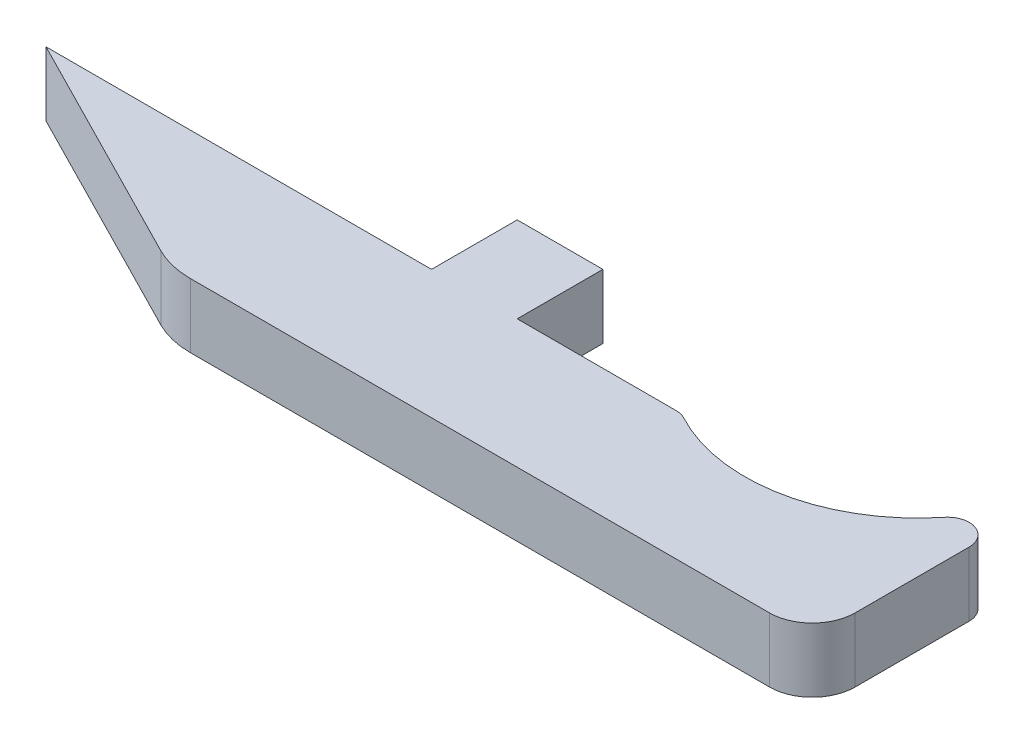
from build123d import *

# Parameters (mm, degrees)
BOSS_EXTRUDE1_DEPTH = 4.7625
FILLET1_R           = 1.5875
FILLET2_R           = 6.35
FILLET3_R           = 3.175
SKETCH6_W           = 6.35
SKETCH6_H           = 4.7625
BOSS_EXTRUDE2_DEPTH = 6.35


with BuildPart() as part:
    # Sketch1 → Boss-Extrude1 (new body)
    with BuildSketch(Plane(origin=(0, 0, 0), x_dir=(1, 0, 0), z_dir=(0, 1, 0))):
        with BuildLine():
            ThreePointArc((71.8451, -2.691968416), (65.44608311, -13.792101845), (52.633598926, -13.817168416))
            Line((52.633598926, -13.817168416), (5.5225, -13.817168416))
            Line((5.5225, -13.817168416), (24.2201, -23.342168416))
            Line((24.2201, -23.342168416), (71.8451, -23.342168416))
            Line((71.8451, -23.342168416), (71.8451, -2.691968416))
        make_face()
    extrude(amount=BOSS_EXTRUDE1_DEPTH)

    # Fillet1
    fillet1_edges = [part.edges().sort_by_distance(p)[0] for p in [
        (71.8451, 2.38125, 2.691968416),
        (52.633598926, 2.38125, 13.817168416),
    ]]
    fillet(fillet1_edges, radius=FILLET1_R)

    # Fillet2
    fillet2_edges = [part.edges().sort_by_distance(p)[0] for p in [
        (24.2201, 2.38125, 23.342168416),
    ]]
    fillet(fillet2_edges, radius=FILLET2_R)

    # Fillet3
    fillet3_edges = [part.edges().sort_by_distance(p)[0] for p in [
        (71.8451, 2.38125, 23.342168416),
    ]]
    fillet(fillet3_edges, radius=FILLET3_R)

    # Sketch6 → Boss-Extrude2 (add)
    with BuildSketch(Plane(origin=(0, 0, 13.817168416), x_dir=(-1, 0, 0), z_dir=(0, 0, -1))):
        with Locations((-37.2725, 2.38125)):
            Rectangle(SKETCH6_W, SKETCH6_H)
    extrude(amount=BOSS_EXTRUDE2_DEPTH)


solid = part.part
